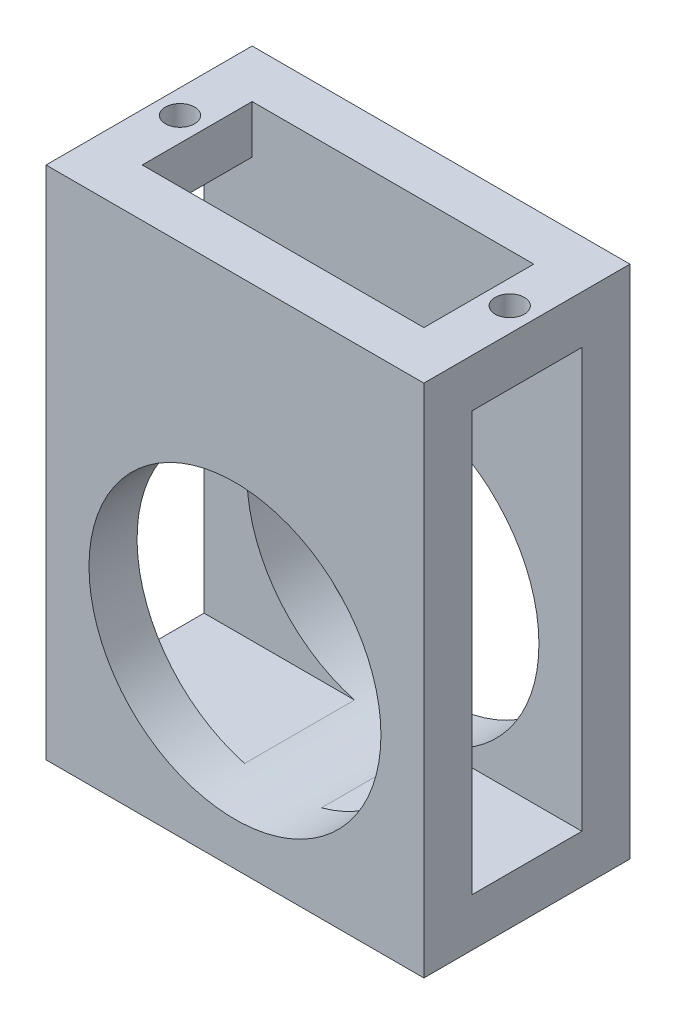
from build123d import *

# Parameters (mm, degrees)
SKETCH1_W           = 55
SKETCH1_H           = 75
BOSS_EXTRUDE1_DEPTH = 30
SKETCH2_R           = 21.25
CUT_EXTRUDE1_DEPTH  = 30
SKETCH3_W           = 41
SKETCH3_H           = 16
CUT_EXTRUDE2_DEPTH  = 60
SKETCH4_W           = 16
SKETCH4_H           = 61
CUT_EXTRUDE3_DEPTH  = 60
SKETCH5_R           = 2.125
CUT_EXTRUDE4_DEPTH  = 10


with BuildPart() as part:
    # Sketch1 → Boss-Extrude1 (new body)
    with BuildSketch(Plane.XY):
        with Locations((0, 10)):
            Rectangle(SKETCH1_W, SKETCH1_H)
    extrude(amount=BOSS_EXTRUDE1_DEPTH)

    # Sketch2 → Cut-Extrude1 (cut)
    with BuildSketch(Plane.XY.offset(30)):
        Circle(SKETCH2_R)
    extrude(amount=-CUT_EXTRUDE1_DEPTH, mode=Mode.SUBTRACT)

    # Sketch3 → Cut-Extrude2 (cut)
    with BuildSketch(Plane(origin=(0, 47.5, 0), x_dir=(1, 0, 0), z_dir=(0, 1, 0))):
        with Locations((0, -15)):
            Rectangle(SKETCH3_W, SKETCH3_H)
    extrude(amount=-CUT_EXTRUDE2_DEPTH, mode=Mode.SUBTRACT)

    # Sketch4 → Cut-Extrude3 (cut)
    with BuildSketch(Plane(origin=(27.5, 0, 0), x_dir=(0, 0, -1), z_dir=(1, 0, 0))):
        with Locations((-15, 10)):
            Rectangle(SKETCH4_W, SKETCH4_H)
    extrude(amount=-CUT_EXTRUDE3_DEPTH, mode=Mode.SUBTRACT)

    # Sketch5 → Cut-Extrude4 (cut)
    with BuildSketch(Plane(origin=(0, 47.5, 0), x_dir=(1, 0, 0), z_dir=(0, 1, 0))):
        with Locations(Location((-24, -14, 0), (0, 0, 270))):
            Circle(SKETCH5_R)
        with Locations(Location((24, -14, 0), (0, 0, 270))):
            Circle(SKETCH5_R)
    extrude(amount=-CUT_EXTRUDE4_DEPTH, mode=Mode.SUBTRACT)


solid = part.part
